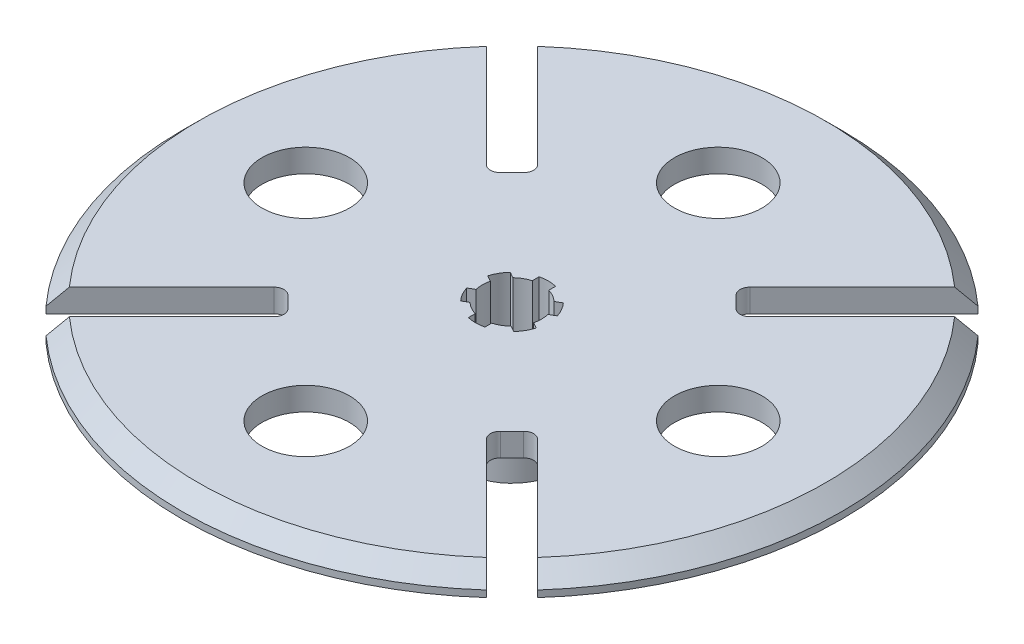
from build123d import *

# Parameters (mm, degrees)
SKETCH_1_R               = 15
SKETCH_1_R_2             = 9
EXTRUDE_1_DEPTH          = 30
SKETCH_2_R               = 100
SKETCH_2_R_2             = 15
SKETCH_2_R_3             = 9
EXTRUDE_2_DEPTH          = 7
CUT_EXTRUDE_1_DEPTH      = 147.181394165
PATTERN_CIRCULAR_1_COUNT = 6
FILLET_1_R               = 10
HOLE_WIZARD_M30_1_D      = 26.5
HOLE_WIZARD_M30_1_DEPTH  = 62.538596798
HOLE_WIZARD_M30_1_TIP    = 7.961403202
CHAMFER_1_SIZE           = 5
CUT_EXTRUDE_1_2_DEPTH    = 145.568322948
PATTERN_CIRCULAR_2_COUNT = 4
FILLET_2_R               = 3


with BuildPart() as part:
    # 草图1 → 凸台-拉伸1 (new body)
    with BuildSketch(Plane(origin=(0, 0, 0), x_dir=(1, 0, 0), z_dir=(0, 1, 0))):
        with Locations(Location((0, 0, 0), (0, 0, 270))):
            Circle(SKETCH_1_R)
        with Locations(Location((0, 0, 0), (0, 0, 270))):
            Circle(SKETCH_1_R_2, mode=Mode.SUBTRACT)
    extrude(amount=EXTRUDE_1_DEPTH)

    # 草图2 → 凸台-拉伸2 (add)
    # profile 1 of 2: a face of its own
    with BuildSketch(Plane(origin=(0, 30, 0), x_dir=(1, 0, 0), z_dir=(0, 1, 0))):
        with Locations(Location((0, 0, 0), (0, 0, 270))):
            Circle(SKETCH_2_R)
        with Locations(Location((0, 0, 0), (0, 0, 270))):
            Circle(SKETCH_2_R_2, mode=Mode.SUBTRACT)
    # profile 2 of 2: a face of its own
    with BuildSketch(Plane(origin=(0, 30, 0), x_dir=(1, 0, 0), z_dir=(0, 1, 0))):
        with Locations(Location((0, 0, 0), (0, 0, 270))):
            Circle(SKETCH_2_R_2)
        with Locations(Location((0, 0, 0), (0, 0, 270))):
            Circle(SKETCH_2_R_3, mode=Mode.SUBTRACT)
    extrude(amount=EXTRUDE_2_DEPTH)

    # 草图7 → Cut-Extrude 1 (cut, through all)
    with BuildSketch(Plane(origin=(0, 37, 0), x_dir=(1, 0, 0), z_dir=(0, 1, 0))):
        with BuildLine():
            Line((-2.5, -10.712142643), (-2.5, 10.712142643))
            ThreePointArc((-2.5, 10.712142643), (0, 11), (2.5, 10.712142643))
            Line((2.5, 10.712142643), (2.5, -10.712142643))
            ThreePointArc((2.5, -10.712142643), (0, -11), (-2.5, -10.712142643))
        make_face()
    cut_extrude_1 = extrude(amount=-CUT_EXTRUDE_1_DEPTH, mode=Mode.SUBTRACT)

    # 阵列(圆周)1: Cut-Extrude 1 ×6 about axis
    pattern_circular_1_axis = Axis((0, 0, 0), (0, 1, 0))
    for i in range(1, PATTERN_CIRCULAR_1_COUNT):
        add(cut_extrude_1.rotate(pattern_circular_1_axis, i * 360 / PATTERN_CIRCULAR_1_COUNT), mode=Mode.SUBTRACT)

    # 圆角1
    fillet_1_edges = [part.edges().sort_by_distance(p)[0] for p in [
        (0, 30, -15),
    ]]
    fillet(fillet_1_edges, radius=FILLET_1_R)

    # M30 螺纹孔1
    with Locations(Plane(origin=(0, 37, 0), x_dir=(1, 0, 0), z_dir=(0, 1, 0))):
        with Locations((0, 62.5), (62.5, 0), (0, -62.5), (-62.5, 0)):
            Hole(HOLE_WIZARD_M30_1_D / 2, depth=HOLE_WIZARD_M30_1_DEPTH)
            with Locations((0, 0, -(HOLE_WIZARD_M30_1_DEPTH + HOLE_WIZARD_M30_1_TIP / 2))):  # 118° drill point
                Cone(0, HOLE_WIZARD_M30_1_D / 2, HOLE_WIZARD_M30_1_TIP, mode=Mode.SUBTRACT)

    # 倒角1
    chamfer_1_edges = [part.edges().sort_by_distance(p)[0] for p in [
        (0, 37, -100),
    ]]
    chamfer(chamfer_1_edges, length=CHAMFER_1_SIZE)

    # 草图10 → Cut-Extrude 1 2 (cut, symmetric)
    with BuildSketch(Plane.XZ.offset(-30)):
        Polygon((30.0520382, -37.830212793), (66.821590822, -74.599765415), (74.599765415, -66.821590822), (37.830212793, -30.0520382), align=None)
    cut_extrude_1_2 = extrude(amount=CUT_EXTRUDE_1_2_DEPTH, both=True, mode=Mode.SUBTRACT)

    # 阵列(圆周)2: Cut-Extrude 1 2 ×4 about axis
    pattern_circular_2_axis = Axis((0, 0, 0), (0, 1, 0))
    for i in range(1, PATTERN_CIRCULAR_2_COUNT):
        add(cut_extrude_1_2.rotate(pattern_circular_2_axis, i * 360 / PATTERN_CIRCULAR_2_COUNT), mode=Mode.SUBTRACT)

    # 圆角2
    fillet_2_edges = [part.edges().sort_by_distance(p)[0] for p in [
        (30.0520382, 33.5, -37.830212793),
        (37.830212793, 33.5, -30.0520382),
        (37.830212793, 33.5, 30.0520382),
        (30.0520382, 33.5, 37.830212793),
        (-30.0520382, 33.5, 37.830212793),
        (-37.830212793, 33.5, 30.0520382),
        (-37.830212793, 33.5, -30.0520382),
        (-30.0520382, 33.5, -37.830212793),
    ]]
    fillet(fillet_2_edges, radius=FILLET_2_R)


solid = part.part
